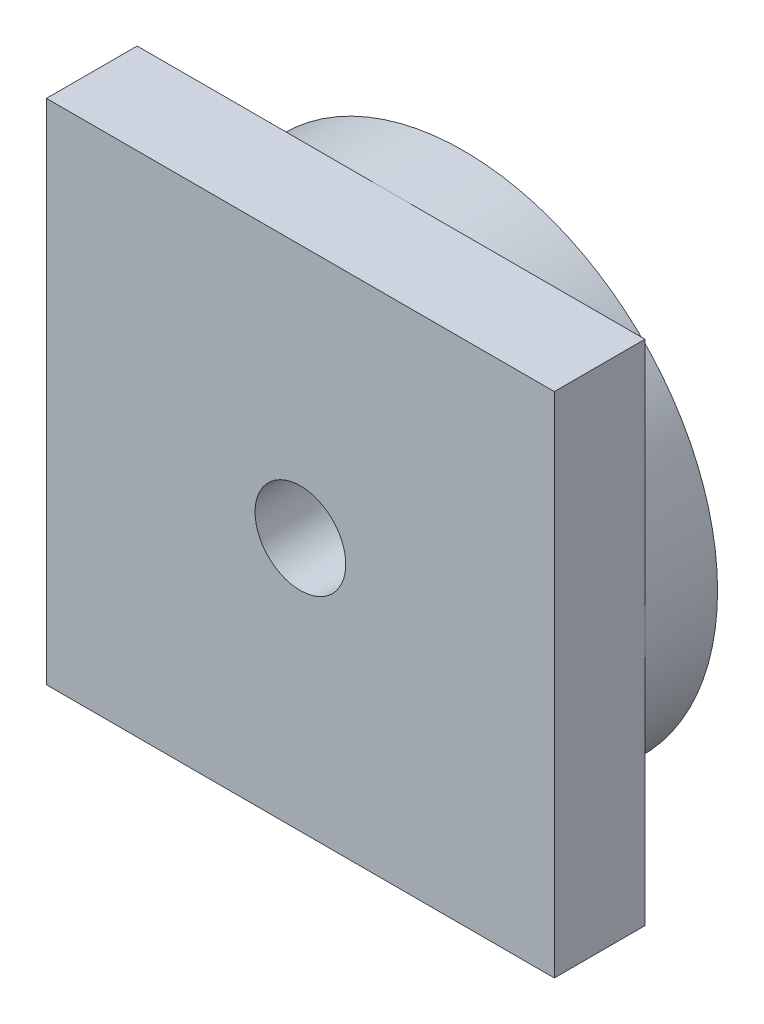
from build123d import *

# Parameters (mm, degrees)
SKETCH1_R           = 28
SKETCH1_R_2         = 18
BOSS_EXTRUDE1_DEPTH = 22
SKETCH2_W           = 56
SKETCH2_H           = 56
BOSS_EXTRUDE2_DEPTH = 10
SKETCH3_W           = 56
SKETCH3_H           = 60.095758966
CUT_EXTRUDE1_DEPTH  = 14
SKETCH4_R           = 5
CUT_EXTRUDE2_DEPTH  = 14
SKETCH5_R           = 21.225012464
SKETCH5_R_2         = 11
BOSS_EXTRUDE3_DEPTH = 8


with BuildPart() as part:
    # Sketch1 → Boss-Extrude1 (new body)
    with BuildSketch(Plane.XY):
        Circle(SKETCH1_R)
        Circle(SKETCH1_R_2, mode=Mode.SUBTRACT)
    extrude(amount=BOSS_EXTRUDE1_DEPTH)

    # Sketch2 → Boss-Extrude2 (add)
    with BuildSketch(Plane.XY.offset(22)):
        Rectangle(SKETCH2_W, SKETCH2_H)
    extrude(amount=BOSS_EXTRUDE2_DEPTH)

    # Sketch3 → Cut-Extrude1 (cut)
    with BuildSketch(Plane(origin=(0, 0, 0), x_dir=(-1, 0, 0), z_dir=(0, 0, -1))):
        with Locations((0, 2.047879483)):
            Rectangle(SKETCH3_W, SKETCH3_H)
    extrude(amount=-CUT_EXTRUDE1_DEPTH, mode=Mode.SUBTRACT)

    # Sketch4 → Cut-Extrude2 (cut)
    with BuildSketch(Plane(origin=(0, 0, 22), x_dir=(-1, 0, 0), z_dir=(0, 0, -1))):
        Circle(SKETCH4_R)
    extrude(amount=-CUT_EXTRUDE2_DEPTH, mode=Mode.SUBTRACT)

    # Sketch5 → Boss-Extrude3 (add)
    with BuildSketch(Plane(origin=(0, 0, 22), x_dir=(-1, 0, 0), z_dir=(0, 0, -1))):
        Circle(SKETCH5_R)
        Circle(SKETCH5_R_2, mode=Mode.SUBTRACT)
    extrude(amount=BOSS_EXTRUDE3_DEPTH)


solid = part.part
